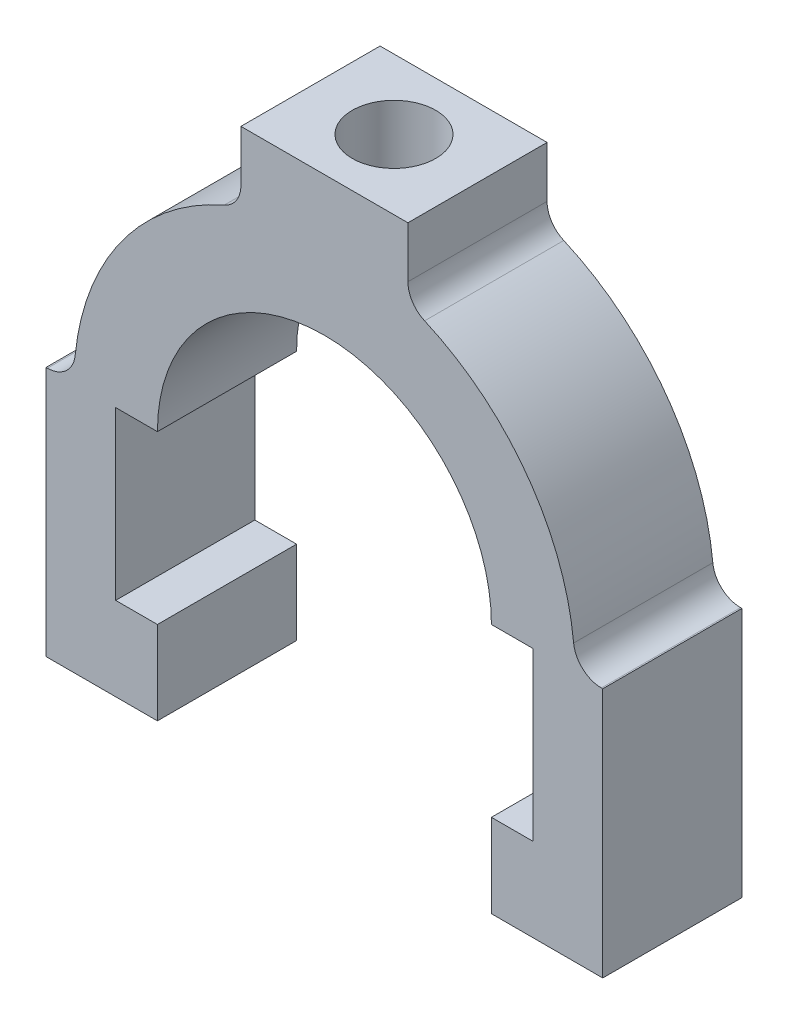
from build123d import *

# Parameters (mm, degrees)
BOSS_EXTRUDE1_DEPTH = 20
SKETCH2_R           = 6
CUT_EXTRUDE2_DEPTH  = 115.891252931


with BuildPart() as part:
    # Sketch1 → Boss-Extrude1 (new body)
    with BuildSketch(Plane.XY):
        with BuildLine():
            Line((0, 0), (0, 36))
            Line((0, 36), (-0.200502516, 36))
            ThreePointArc((-0.200502516, 36), (-2.883784089, 37.033520605), (-4.180452264, 39.6))
            ThreePointArc((-4.180452264, 39.6), (-10.905145426, 57.201165942), (-25.6, 68.994545004))
            ThreePointArc((-25.6, 68.994545004), (-27.346640106, 70.46971533), (-28, 72.66060556))
            Line((-28, 72.66060556), (-28, 80))
            Line((-28, 80), (-52, 80))
            Line((-52, 80), (-52, 72.66060556))
            ThreePointArc((-52, 72.66060556), (-52.653359894, 70.46971533), (-54.4, 68.994545004))
            ThreePointArc((-54.4, 68.994545004), (-69.094854574, 57.201165942), (-75.819547736, 39.6))
            ThreePointArc((-75.819547736, 39.6), (-77.116215911, 37.033520605), (-79.799497484, 36))
            Line((-79.799497484, 36), (-80, 36))
            Line((-80, 36), (-80, 0))
            Line((-80, 0), (-64, 0))
            Line((-64, 0), (-64, 12))
            Line((-64, 12), (-70, 12))
            Line((-70, 12), (-70, 36))
            Line((-70, 36), (-64, 36))
            ThreePointArc((-64, 36), (-40, 60), (-16, 36))
            Line((-16, 36), (-10, 36))
            Line((-10, 36), (-10, 12))
            Line((-10, 12), (-16, 12))
            Line((-16, 12), (-16, 0))
            Line((-16, 0), (0, 0))
        make_face()
    extrude(amount=BOSS_EXTRUDE1_DEPTH)

    # Sketch2 → Cut-Extrude2 (cut, through all)
    with BuildSketch(Plane(origin=(0, 80, 0), x_dir=(1, 0, 0), z_dir=(0, 1, 0))):
        with Locations(Location((-40, -10, 0), (0, 0, 270))):
            Circle(SKETCH2_R)
    extrude(amount=-CUT_EXTRUDE2_DEPTH, mode=Mode.SUBTRACT)


solid = part.part
